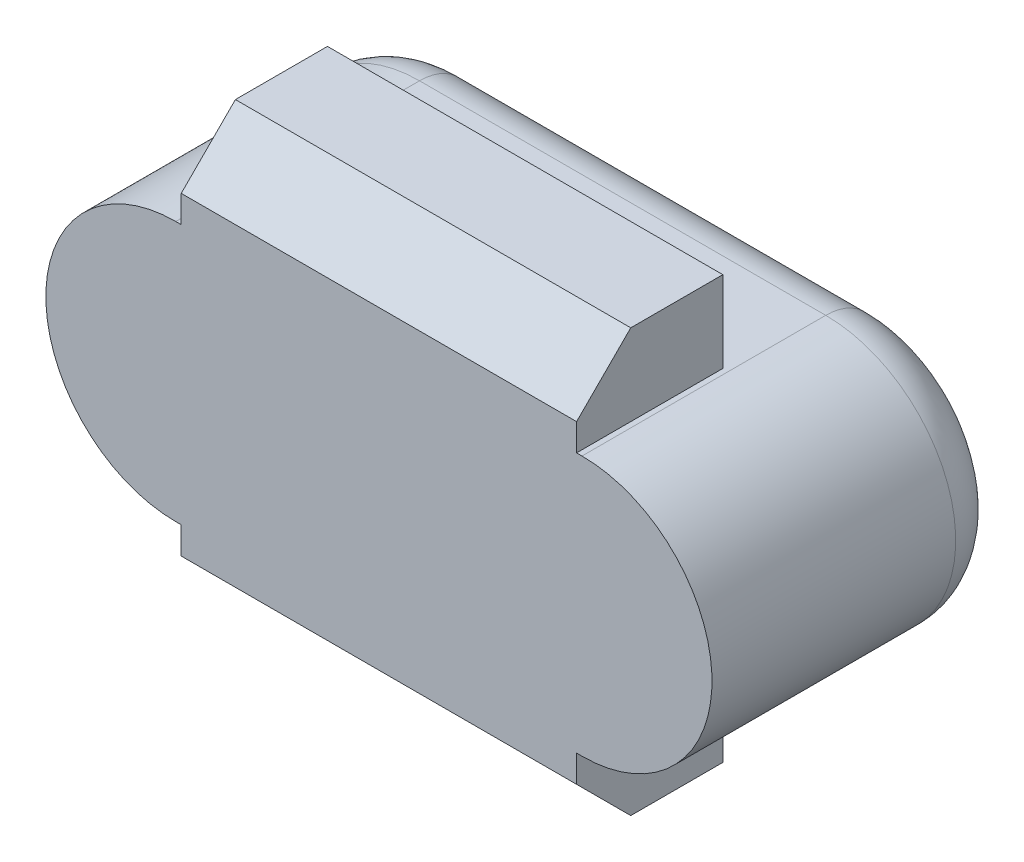
from build123d import *

# Parameters (mm, degrees)
EXTRUDE_1_DEPTH = 5.5
SKETCH_2_W      = 7.3
SKETCH_2_H      = 7.8
EXTRUDE_2_DEPTH = 2.7
FILLET_1_R      = 1
CHAMFER_1_SIZE  = 1


with BuildPart() as part:
    # Эскиз1 → Бобышка-Вытянуть1 (new body)
    with BuildSketch(Plane.XY):
        with BuildLine():
            Line((0, 2.4), (7.5, 2.4))
            ThreePointArc((7.5, 2.4), (9.9, 0), (7.5, -2.4))
            Line((7.5, -2.4), (0, -2.4))
            ThreePointArc((0, -2.4), (-2.4, 0), (0, 2.4))
        make_face()
    extrude(amount=EXTRUDE_1_DEPTH)

    # Эскиз2 → Бобышка-Вытянуть2 (add)
    with BuildSketch(Plane.XY.offset(5.5)):
        with Locations((3.75, 0)):
            Rectangle(SKETCH_2_W, SKETCH_2_H)
    extrude(amount=-EXTRUDE_2_DEPTH)

    # Скругление1
    fillet_1_edges = [part.edges().sort_by_distance(p)[0] for p in [
        (3.75, 2.4, 0),
        (9.9, 0, 0),
        (3.75, -2.4, 0),
        (-2.4, 0, 0),
    ]]
    fillet(fillet_1_edges, radius=FILLET_1_R)

    # Фаска1
    chamfer_1_edges = [part.edges().sort_by_distance(p)[0] for p in [
        (3.75, -3.9, 5.5),
        (3.75, 3.9, 5.5),
    ]]
    chamfer(chamfer_1_edges, length=CHAMFER_1_SIZE)


solid = part.part
